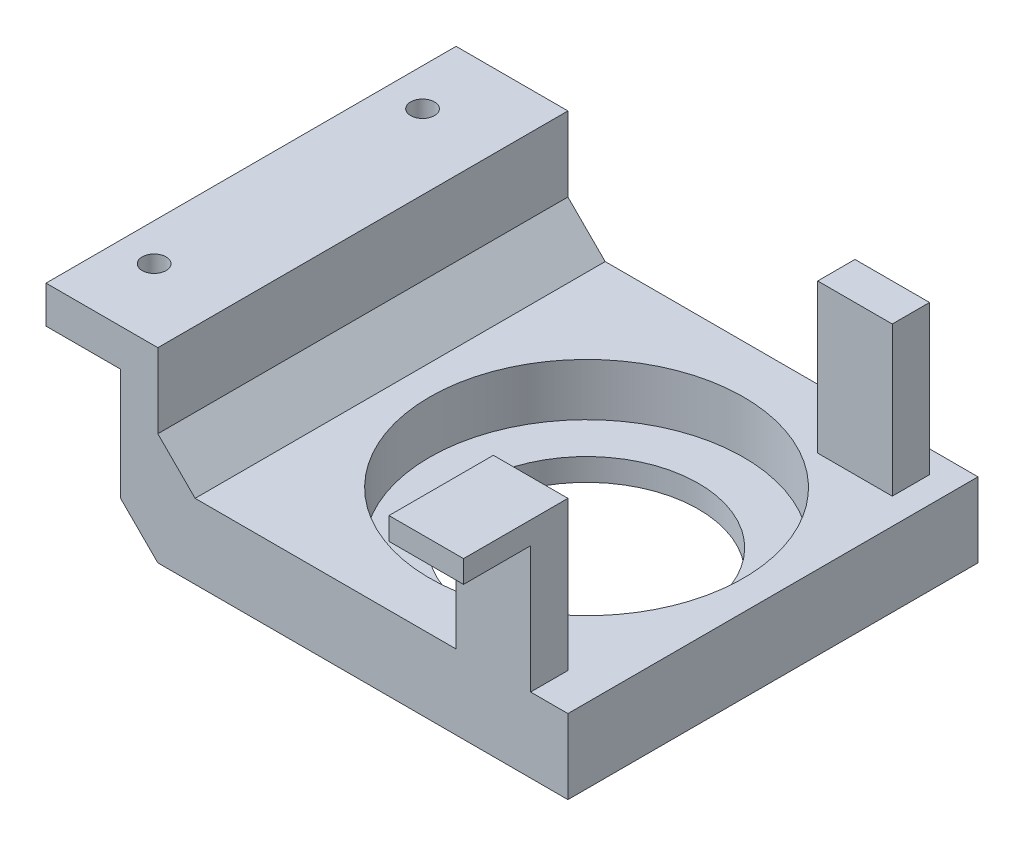
from build123d import *

# Parameters (mm, degrees)
SALIENTE_EXTRUIR2_DEPTH    = 55
CROQUIS6_R                 = 21.05
CORTAR_EXTRUIR1_DEPTH      = 7
CORTAR_EXTRUIR2_DEPTH      = 73.286420098
CORTAR_EXTRUIR2_DEPTH_BACK = 73.286420098
CROQUIS8_R                 = 15
CORTAR_EXTRUIR3_DEPTH      = 72.703044082
CORTAR_EXTRUIR3_DEPTH_BACK = 72.703044082
CROQUIS9_R                 = 1.6
CHAFL_N1_SIZE              = 5
CROQUIS11_W                = 10
CROQUIS11_H                = 5
SALIENTE_EXTRUIR3_DEPTH    = 20
CROQUIS12_W                = 10
CROQUIS12_H                = 3
SALIENTE_EXTRUIR4_DEPTH    = 9
CROQUIS13_W                = 10
CROQUIS13_H                = 5
SALIENTE_EXTRUIR5_DEPTH    = 20


with BuildPart() as part:
    # Croquis4 → Saliente-Extruir2 (new body)
    with BuildSketch(Plane.XY):
        Polygon((-31.428571429, 5.761904762), (-31.428571429, 14.761904762), (-41.428571429, 14.761904762), (-41.428571429, 19.761904762), (-26.428571429, 19.761904762), (-26.428571429, 4.761904762), (28.571428571, 4.761904762), (28.571428571, -5.238095238), (-31.428571429, -5.238095238), align=None)
    extrude(amount=SALIENTE_EXTRUIR2_DEPTH)

    # Croquis6 → Cortar-Extruir1 (cut)
    with BuildSketch(Plane(origin=(0, 4.761904762, 0), x_dir=(1, 0, 0), z_dir=(0, 1, 0))):
        with Locations(Location((3.571428571, -27.5, 0), (0, 0, 180))):
            Circle(CROQUIS6_R)
    extrude(amount=-CORTAR_EXTRUIR1_DEPTH, mode=Mode.SUBTRACT)

    # Croquis8 → Cortar-Extruir2 (cut, two sides: drawn at the far end of the back side and taken through both)
    with BuildSketch(Plane(origin=(0, -2.238095238, 0), x_dir=(1, 0, 0), z_dir=(0, 1, 0)).offset(-CORTAR_EXTRUIR2_DEPTH_BACK)):
        with Locations(Location((3.571428571, -27.5, 0), (0, 0, 180))):
            Circle(CROQUIS8_R)
    extrude(amount=CORTAR_EXTRUIR2_DEPTH + CORTAR_EXTRUIR2_DEPTH_BACK, mode=Mode.SUBTRACT)

    # Croquis9 → Cortar-Extruir3 (cut, two sides: drawn at the far end of the back side and taken through both)
    with BuildSketch(Plane.XZ.offset(-14.761904762).offset(-CORTAR_EXTRUIR3_DEPTH_BACK)):
        with Locations((-36.428571429, 45.5)):
            Circle(CROQUIS9_R)
        with Locations(Location((-36.428571429, 9.5, 0), (0, 0, 180))):
            Circle(CROQUIS9_R)
    extrude(amount=CORTAR_EXTRUIR3_DEPTH + CORTAR_EXTRUIR3_DEPTH_BACK, mode=Mode.SUBTRACT)

    # Chaflán1
    chafl_n1_edges = [part.edges().sort_by_distance(p)[0] for p in [
        (-31.428571429, -5.238095238, 27.5),
        (-26.428571429, 4.761904762, 27.5),
    ]]
    chamfer(chafl_n1_edges, length=CHAFL_N1_SIZE)

    # Croquis11 → Saliente-Extruir3 (add)
    with BuildSketch(Plane(origin=(0, 4.761904762, 0), x_dir=(1, 0, 0), z_dir=(0, 1, 0))):
        with Locations((18.571428571, -52.5)):
            Rectangle(CROQUIS11_W, CROQUIS11_H)
    extrude(amount=SALIENTE_EXTRUIR3_DEPTH)

    # Croquis12 → Saliente-Extruir4 (add)
    with BuildSketch(Plane.XY.offset(55)):
        with Locations((18.571428571, 23.261904762)):
            Rectangle(CROQUIS12_W, CROQUIS12_H)
    extrude(amount=SALIENTE_EXTRUIR4_DEPTH)

    # Croquis13 → Saliente-Extruir5 (add)
    with BuildSketch(Plane(origin=(0, 4.761904762, 0), x_dir=(1, 0, 0), z_dir=(0, 1, 0))):
        with Locations((20.071428571, -5.5)):
            Rectangle(CROQUIS13_W, CROQUIS13_H)
    extrude(amount=SALIENTE_EXTRUIR5_DEPTH)


solid = part.part
